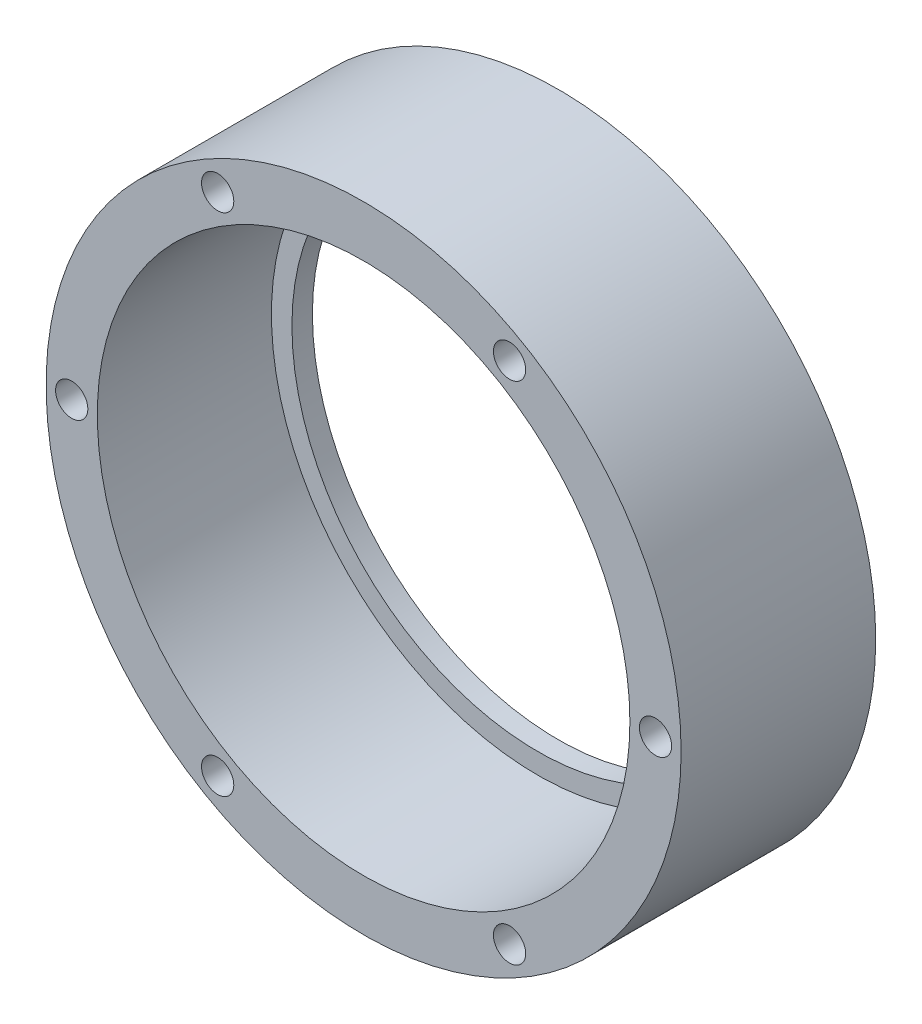
from build123d import *

# Parameters (mm, degrees)
PATTERN_CIRCULAR_1_COUNT = 6


with BuildPart() as part:
    # Эскиз1 → Повернуть1 (revolve)
    with BuildSketch(Plane(origin=(0, 0, 0), x_dir=(0, 0, -1), z_dir=(1, 0, 0)), mode=Mode.PRIVATE) as revolve_1_sk:
        Polygon((0, 31), (19, 31), (19, 24), (17, 24), (17, 26), (0, 26), align=None)
    revolve(revolve_1_sk.sketch.rotate(Axis((0, 0, 0), (0, 0, -1)), 90), axis=Axis((0, 0, 0), (0, 0, -1)))

    # Эскиз3 → Сверло под метчик  спиральное M31 (revolve, cut)
    with BuildSketch(Plane(origin=(28.5, 0, 0), x_dir=(0, -1, 0), z_dir=(1, 0, 0))):
        Polygon((0, 0), (0, 8.946355475), (1.575, 8), (1.575, 0), align=None)
    hole_wizard_m31 = revolve(axis=Axis((28.5, 0, 6.35), (0, 0, -1)), mode=Mode.SUBTRACT)

    # Круговой массив1: Сверло под метчик  спиральное M31 ×6 about axis
    pattern_circular_1_axis = Axis((0, 0, 0), (0, 0, 1))
    for i in range(1, PATTERN_CIRCULAR_1_COUNT):
        add(hole_wizard_m31.rotate(pattern_circular_1_axis, i * 360 / PATTERN_CIRCULAR_1_COUNT), mode=Mode.SUBTRACT)


solid = part.part
